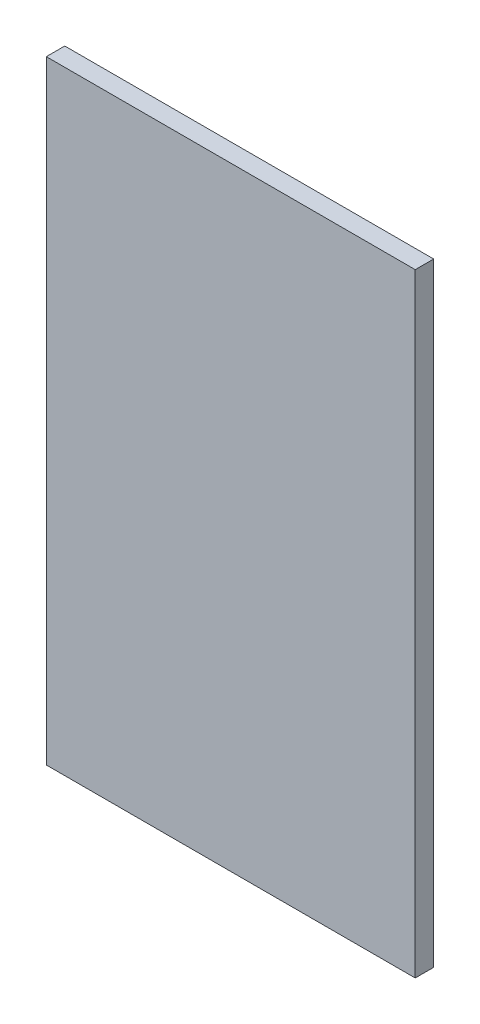
from build123d import *

# Parameters (mm, degrees)
SKETCH1_W           = 1000
SKETCH1_H           = 1662.9
BOSS_EXTRUDE1_DEPTH = 50


with BuildPart() as part:
    # Sketch1 → Boss-Extrude1 (new body)
    with BuildSketch(Plane.XY):
        with Locations((500, 831.45)):
            Rectangle(SKETCH1_W, SKETCH1_H)
    extrude(amount=BOSS_EXTRUDE1_DEPTH)


solid = part.part
